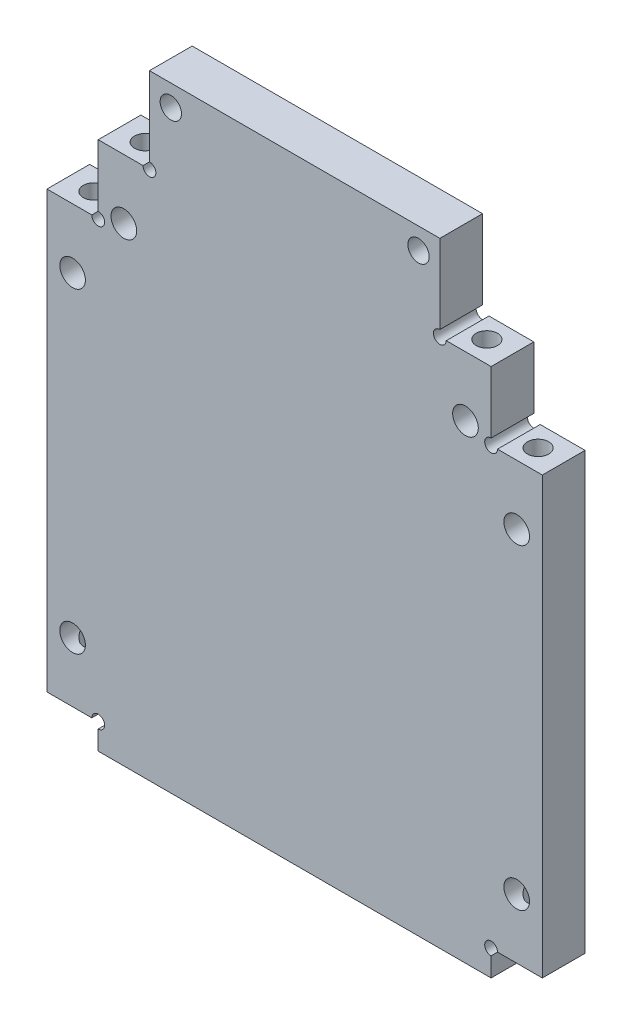
from build123d import *

# Parameters (mm, degrees)
EXTRUDE_1_DEPTH     = 5
SKETCH_2_R          = 1.25
CUT_EXTRUDE_1_DEPTH = 7.5
SKETCH_3_R          = 1.25
CUT_EXTRUDE_2_DEPTH = 7.5
SKETCH_4_R          = 1.25
CUT_EXTRUDE_3_DEPTH = 76.013332148
SKETCH_5_R          = 0.75
CUT_EXTRUDE_4_DEPTH = 76.013332148
SKETCH_7_R          = 1.5
CUT_EXTRUDE_6_DEPTH = 76.013332148


with BuildPart() as part:
    # ｽｹｯﾁ1 → ﾎﾞｽ - 押し出し1 (new body)
    with BuildSketch(Plane.XY):
        Polygon((-29, 51), (-29, 0), (-23, 0), (-23, -3), (23, -3), (23, 0), (29, 0), (29, 51), (23, 51), (23, 59), (17, 59), (17, 69), (-17, 69), (-17, 59), (-23, 59), (-23, 51), align=None)
    extrude(amount=EXTRUDE_1_DEPTH)

    # ｽｹｯﾁ2 → ｶｯﾄ - 押し出し1 (cut)
    with BuildSketch(Plane(origin=(0, 59, 0), x_dir=(1, 0, 0), z_dir=(0, 1, 0))):
        with Locations(Location((-20, -2.5, 0), (0, 0, 270))):
            Circle(SKETCH_2_R)
        with Locations(Location((20, -2.5, 0), (0, 0, 270))):
            Circle(SKETCH_2_R)
    extrude(amount=-CUT_EXTRUDE_1_DEPTH, mode=Mode.SUBTRACT)

    # ｽｹｯﾁ3 → ｶｯﾄ - 押し出し2 (cut)
    with BuildSketch(Plane(origin=(0, 51, 0), x_dir=(1, 0, 0), z_dir=(0, 1, 0))):
        with Locations(Location((-26, -2.5, 0), (0, 0, 270))):
            Circle(SKETCH_3_R)
        with Locations(Location((26, -2.5, 0), (0, 0, 270))):
            Circle(SKETCH_3_R)
    cut_extrude_2 = extrude(amount=-CUT_EXTRUDE_2_DEPTH, mode=Mode.SUBTRACT)

    # ﾐﾗｰ1: ｶｯﾄ - 押し出し2 across plane
    add(cut_extrude_2.mirror(Plane.ZX.offset(25.5)), mode=Mode.SUBTRACT)

    # ｽｹｯﾁ4 → ｶｯﾄ - 押し出し3 (cut, through all)
    with BuildSketch(Plane(origin=(0, 0, 0), x_dir=(-1, 0, 0), z_dir=(0, 0, -1))):
        with Locations((-14.5, 66.5)):
            Circle(SKETCH_4_R)
        with Locations((14.5, 66.5)):
            Circle(SKETCH_4_R)
    extrude(amount=-CUT_EXTRUDE_3_DEPTH, mode=Mode.SUBTRACT)

    # ｽｹｯﾁ5 → ｶｯﾄ - 押し出し4 (cut, through all)
    with BuildSketch(Plane(origin=(0, 0, 0), x_dir=(-1, 0, 0), z_dir=(0, 0, -1))):
        with Locations((-17, 59)):
            Circle(SKETCH_5_R)
        with Locations((-23, 51)):
            Circle(SKETCH_5_R)
        with Locations((-23, 0)):
            Circle(SKETCH_5_R)
        with Locations((17, 59)):
            Circle(SKETCH_5_R)
        with Locations((23, 51)):
            Circle(SKETCH_5_R)
        with Locations((23, 0)):
            Circle(SKETCH_5_R)
    extrude(amount=-CUT_EXTRUDE_4_DEPTH, mode=Mode.SUBTRACT)

    # ｽｹｯﾁ7 → ｶｯﾄ - 押し出し6 (cut, through all)
    with BuildSketch(Plane.XY.offset(5)):
        with Locations((-26, 44)):
            Circle(SKETCH_7_R)
        with Locations(Location((-26, 7, 0), (0, 0, 180))):
            Circle(SKETCH_7_R)
        with Locations((-20, 52)):
            Circle(SKETCH_7_R)
        with Locations(Location((20, 52, 0), (0, 0, 180))):
            Circle(SKETCH_7_R)
        with Locations((26, 7)):
            Circle(SKETCH_7_R)
        with Locations(Location((26, 44, 0), (0, 0, 180))):
            Circle(SKETCH_7_R)
    extrude(amount=-CUT_EXTRUDE_6_DEPTH, mode=Mode.SUBTRACT)


solid = part.part
